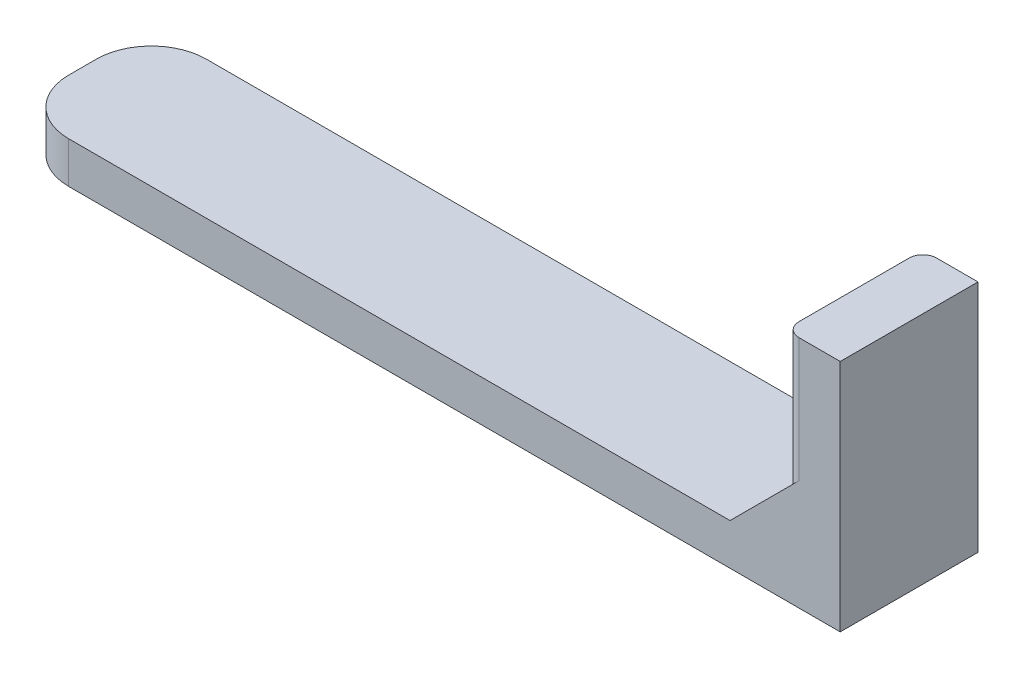
from build123d import *

# Parameters (mm, degrees)
ESBO_O1_W                = 30
ESBO_O1_H                = 5
RESSALTO_EXTRUS_O1_DEPTH = 1.5
ESBO_O2_W                = 2
ESBO_O2_H                = 5
RESSALTO_EXTRUS_O2_DEPTH = 7
FILETE1_R                = 2
FILETE2_R                = 2
CHANFRO1_SIZE            = 2
FILETE4_R                = 0.5
FILETE5_R                = 0.5


with BuildPart() as part:
    # Esboço1 → Ressalto-extrusão1 (new body)
    with BuildSketch(Plane(origin=(0, 0, 0), x_dir=(1, 0, 0), z_dir=(0, 1, 0))):
        Rectangle(ESBO_O1_W, ESBO_O1_H)
    extrude(amount=RESSALTO_EXTRUS_O1_DEPTH)

    # Esboço2 → Ressalto-extrusão2 (add)
    with BuildSketch(Plane(origin=(0, 1.5, 0), x_dir=(1, 0, 0), z_dir=(0, 1, 0))):
        with Locations((14, 0)):
            Rectangle(ESBO_O2_W, ESBO_O2_H)
    extrude(amount=RESSALTO_EXTRUS_O2_DEPTH)

    # Filete1
    filete1_edges = [part.edges().sort_by_distance(p)[0] for p in [
        (-15, 0.75, 2.5),
    ]]
    fillet(filete1_edges, radius=FILETE1_R)

    # Filete2
    filete2_edges = [part.edges().sort_by_distance(p)[0] for p in [
        (-15, 0.75, -2.5),
    ]]
    fillet(filete2_edges, radius=FILETE2_R)

    # Chanfro1
    chanfro1_edges = [part.edges().sort_by_distance(p)[0] for p in [
        (13, 1.5, 0),
    ]]
    chamfer(chanfro1_edges, length=CHANFRO1_SIZE)

    # Filete4
    filete4_edges = [part.edges().sort_by_distance(p)[0] for p in [
        (13, 6, 2.5),
    ]]
    fillet(filete4_edges, radius=FILETE4_R)

    # Filete5
    filete5_edges = [part.edges().sort_by_distance(p)[0] for p in [
        (13, 6, -2.5),
    ]]
    fillet(filete5_edges, radius=FILETE5_R)


solid = part.part
